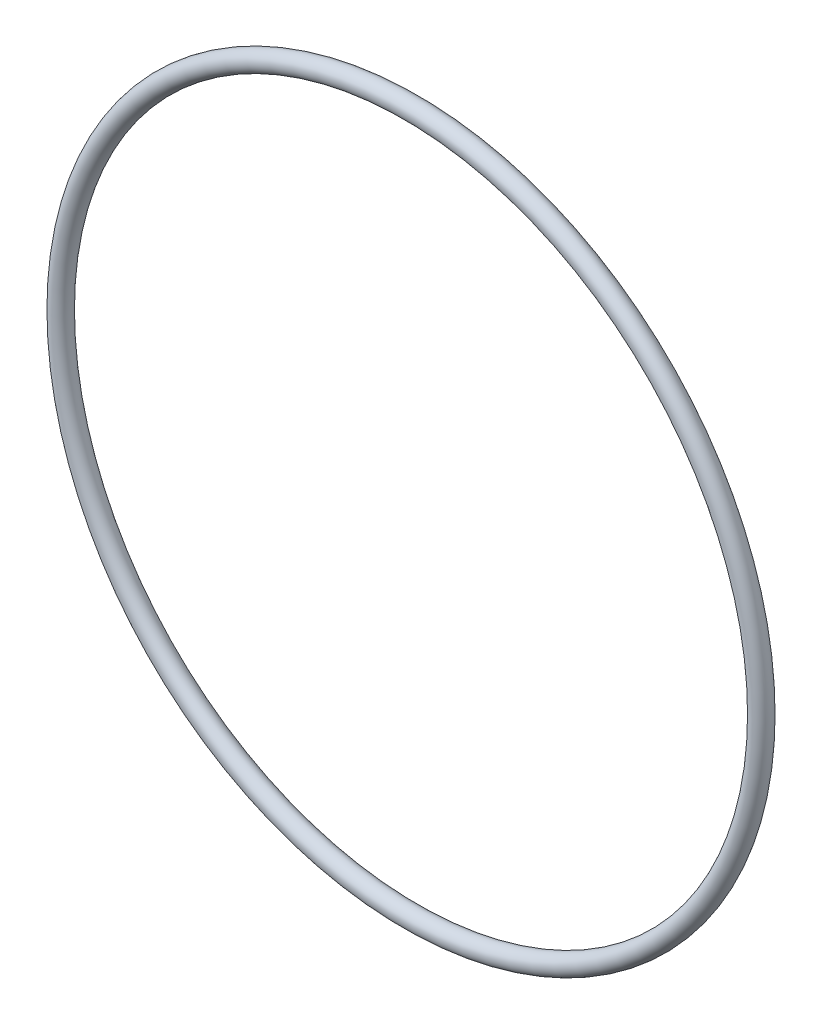
from build123d import *

# Parameters (mm, degrees)
SKETCH1_R = 1.7653


with BuildPart() as part:
    # Sketch1 → Revolve1 (revolve)
    with BuildSketch(Plane(origin=(0, 0, 0), x_dir=(0, -1, 0), z_dir=(1, 0, 0)), mode=Mode.PRIVATE) as revolve1_sk:
        with Locations((63.4746, 0)):
            Circle(SKETCH1_R)
    revolve(revolve1_sk.sketch.rotate(Axis((0, 0, 1.7653), (0, 0, -1)), 270), axis=Axis((0, 0, 1.7653), (0, 0, -1)))


solid = part.part
